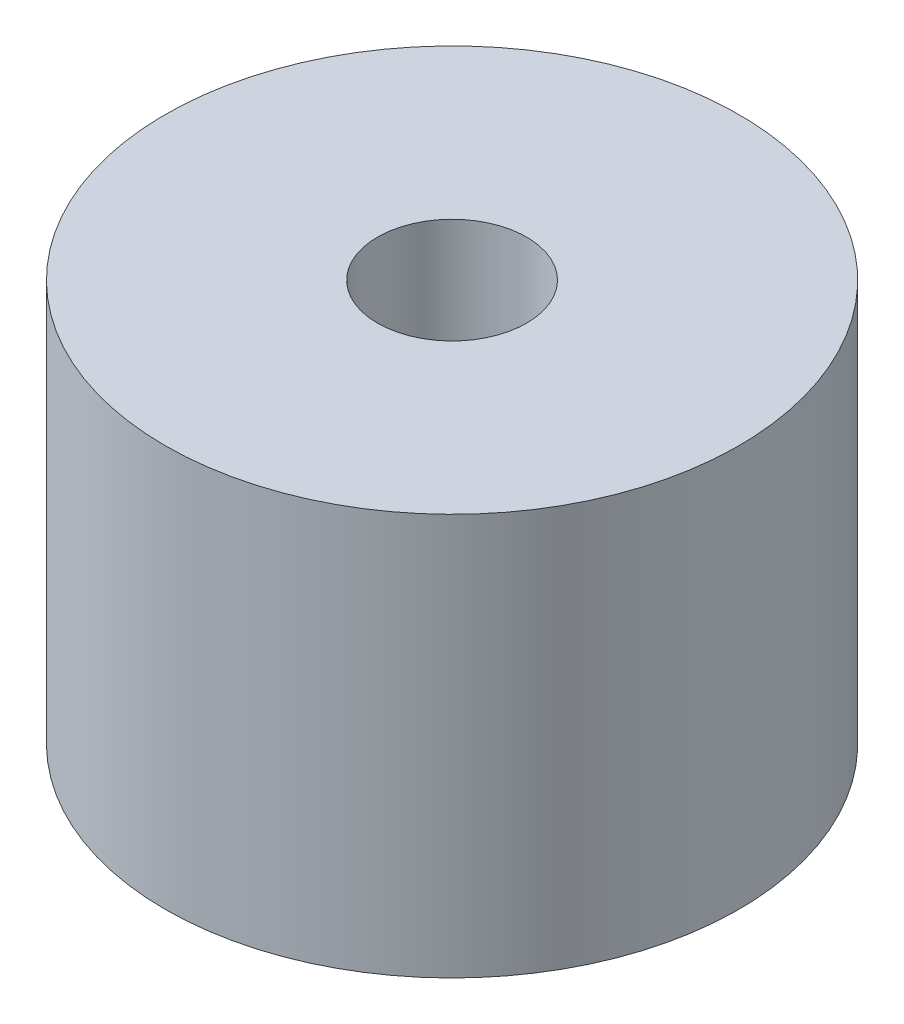
from build123d import *

# Parameters (mm, degrees)
IZIM1_R                     = 25
Y_KSEKLIK_EKSTR_ZYON1_DEPTH = 35
IZIM2_R                     = 6.5
KES_EKSTR_ZYON1_DEPTH       = 30
IZIM3_R                     = 2.5
KES_EKSTR_ZYON2_DEPTH       = 3
IZIM4_R                     = 1.5
KES_EKSTR_ZYON3_DEPTH       = 49.363209157


with BuildPart() as part:
    # Çizim1 → Yükseklik-Ekstrüzyon1 (new body)
    with BuildSketch(Plane(origin=(0, 0, 0), x_dir=(1, 0, 0), z_dir=(0, 1, 0))):
        with Locations(Location((0, 0, 0), (0, 0, 270))):
            Circle(IZIM1_R)
    extrude(amount=Y_KSEKLIK_EKSTR_ZYON1_DEPTH)

    # Çizim2 → Kes-Ekstrüzyon1 (cut)
    with BuildSketch(Plane(origin=(0, 35, 0), x_dir=(1, 0, 0), z_dir=(0, 1, 0))):
        with Locations(Location((0, 0, 0), (0, 0, 270))):
            Circle(IZIM2_R)
    extrude(amount=-KES_EKSTR_ZYON1_DEPTH, mode=Mode.SUBTRACT)

    # Çizim3 → Kes-Ekstrüzyon2 (cut)
    with BuildSketch(Plane(origin=(0, 5, 0), x_dir=(1, 0, 0), z_dir=(0, 1, 0))):
        with Locations(Location((0, 0, 0), (0, 0, 270))):
            Circle(IZIM3_R)
    extrude(amount=-KES_EKSTR_ZYON2_DEPTH, mode=Mode.SUBTRACT)

    # Çizim4 → Kes-Ekstrüzyon3 (cut, through all)
    with BuildSketch(Plane(origin=(0, 2, 0), x_dir=(1, 0, 0), z_dir=(0, 1, 0))):
        with Locations(Location((0, 0, 0), (0, 0, 270))):
            Circle(IZIM4_R)
    extrude(amount=-KES_EKSTR_ZYON3_DEPTH, mode=Mode.SUBTRACT)


solid = part.part
